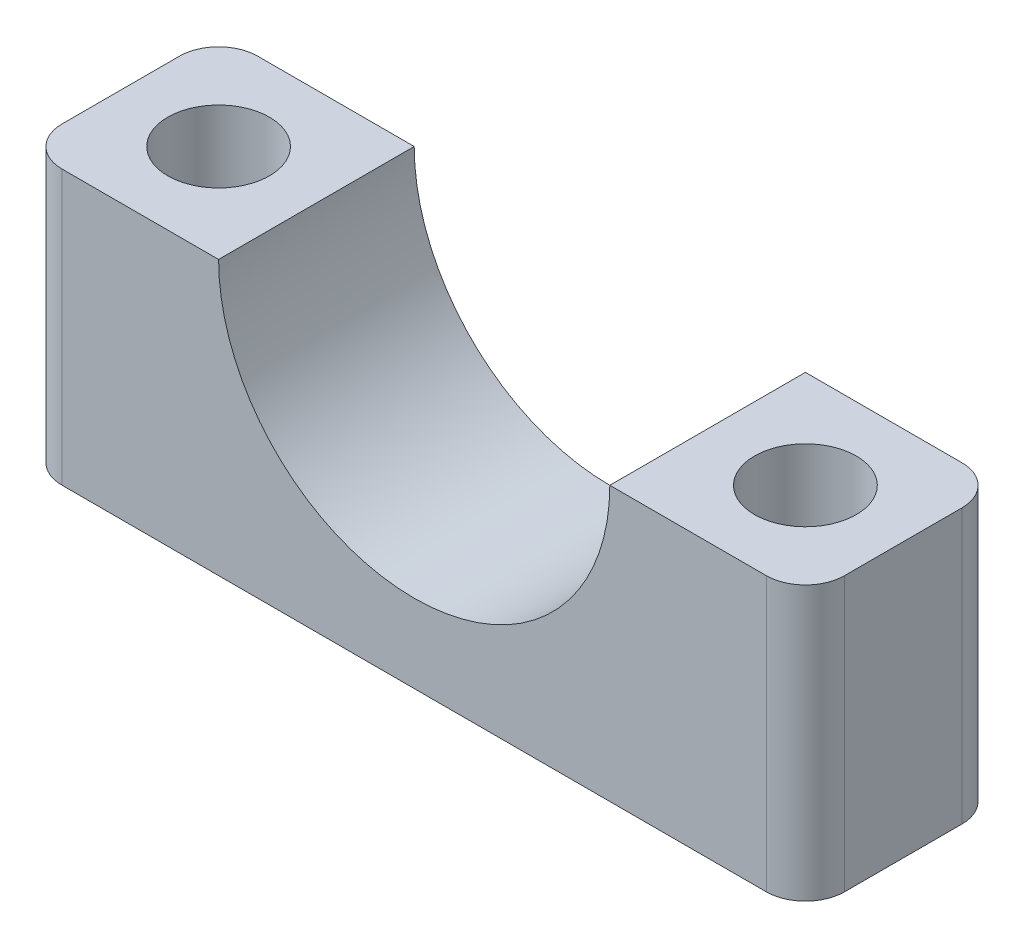
from build123d import *

# Parameters (mm, degrees)
BOSS_EXTRUDE1_DEPTH = 10
FILLET1_R           = 2
SKETCH4_R           = 2.6
CUT_EXTRUDE2_DEPTH  = 27.381811917


with BuildPart() as part:
    # Sketch1 → Boss-Extrude1 (new body)
    with BuildSketch(Plane.XY):
        with BuildLine():
            Line((10, 0), (20, 0))
            Line((20, 0), (20, -14))
            Line((20, -14), (-20, -14))
            Line((-20, -14), (-20, 0))
            Line((-20, 0), (-10, 0))
            ThreePointArc((-10, 0), (0, -10), (10, 0))
        make_face()
    extrude(amount=BOSS_EXTRUDE1_DEPTH)

    # Fillet1
    fillet1_edges = [part.edges().sort_by_distance(p)[0] for p in [
        (-20, -7, 10),
        (20, -7, 10),
        (20, -7, 0),
        (-20, -7, 0),
    ]]
    fillet(fillet1_edges, radius=FILLET1_R)

    # Sketch4 → Cut-Extrude2 (cut, through all)
    with BuildSketch(Plane(origin=(0, 0, 0), x_dir=(1, 0, 0), z_dir=(0, 1, 0))):
        with Locations(Location((-15, -5, 0), (0, 0, 180))):
            Circle(SKETCH4_R)
        with Locations(Location((15, -5, 0), (0, 0, 180))):
            Circle(SKETCH4_R)
    extrude(amount=-CUT_EXTRUDE2_DEPTH, mode=Mode.SUBTRACT)


solid = part.part
